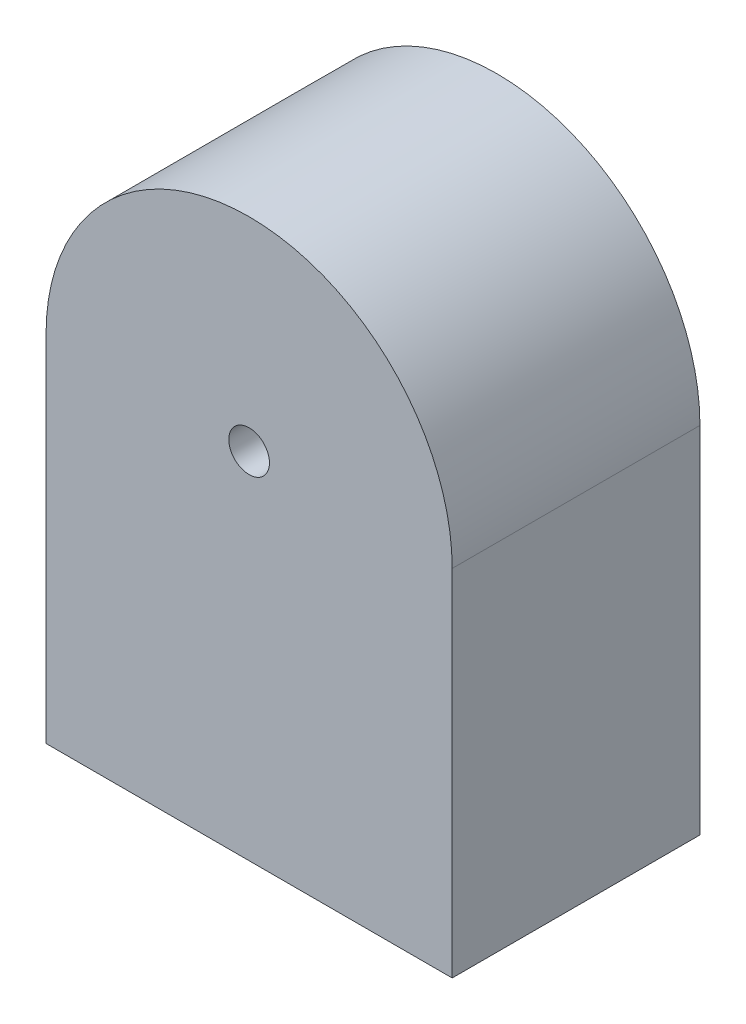
from build123d import *

# Parameters (mm, degrees)
ESQUISSE2_R           = 1.5
BOSS_EXTRU_2_DEPTH    = 18.3
BOSS_EXTRU_3_DEPTH    = 10
BOSS_EXTRU_3_2_DEPTH  = 10
BOSS_EXTRU_3_3_DEPTH  = 10
BOSS_EXTRU_3_4_DEPTH  = 10
BOSS_EXTRU_3_5_DEPTH  = 10
BOSS_EXTRU_3_6_DEPTH  = 10
BOSS_EXTRU_3_7_DEPTH  = 10
BOSS_EXTRU_3_8_DEPTH  = 10
BOSS_EXTRU_3_9_DEPTH  = 10
BOSS_EXTRU_3_10_DEPTH = 10
BOSS_EXTRU_3_11_DEPTH = 10
BOSS_EXTRU_3_12_DEPTH = 10
BOSS_EXTRU_3_13_DEPTH = 10
BOSS_EXTRU_3_14_DEPTH = 10
BOSS_EXTRU_3_15_DEPTH = 10
BOSS_EXTRU_3_16_DEPTH = 10
BOSS_EXTRU_3_17_DEPTH = 10
BOSS_EXTRU_3_18_DEPTH = 10
BOSS_EXTRU_3_19_DEPTH = 10


with BuildPart() as part:
    # Esquisse2 → Boss.-Extru.2 (new body)
    with BuildSketch(Plane.XY):
        with BuildLine():
            Line((0, 0), (30, 0))
            Line((30, 0), (30, 26.2))
            ThreePointArc((30, 26.2), (15, 41.2), (0, 26.2))
            Line((0, 26.2), (0, 0))
        make_face()
        with Locations((15, 26.2)):
            Circle(ESQUISSE2_R, mode=Mode.SUBTRACT)
    extrude(amount=BOSS_EXTRU_2_DEPTH)


with BuildPart() as body_2:
    # Esquisse7 → Boss.-Extru.3 (new body)
    with BuildSketch(Plane(origin=(0, 0, 0), x_dir=(0, 0, -1), z_dir=(1, 0, 0))):
        Polygon((-7.037443522, 3.676127023), (-3.537443522, 4.138166286), (-3.537443522, 4.183038081), (-6.409238393, 5.6280501), (-3.537443522, 7.06955651), (-3.537443522, 7.115129427), (-7.037443522, 7.579973177), (-7.037443522, 7.264468369), (-4.519014034, 6.929332151), (-7.037443522, 5.665910677), (-7.037443522, 5.595097376), (-4.51340506, 4.326768049), (-7.037443522, 3.992332953), align=None)
    extrude(amount=BOSS_EXTRU_3_DEPTH)


with BuildPart() as body_3:
    # Esquisse7 → Boss.-Extru.3 2 (new body)
    with BuildSketch(Plane(origin=(0, 0, 0), x_dir=(0, 0, -1), z_dir=(1, 0, 0))):
        with BuildLine():
            Line((-4.479751214, 10.810742408), (-7.037443522, 10.810742408))
            Line((-7.037443522, 10.810742408), (-7.037443522, 10.496639844))
            Line((-7.037443522, 10.496639844), (-6.595035669, 10.496639844))
            add(Edge.make_bspline(
                [(-6.595035669, 10.496639844), (-6.63508607, 10.461228459), (-6.713244931, 10.392122698), (-6.815048695, 10.276722712), (-6.899889849, 10.154907594), (-6.967776668, 10.026265422), (-7.019159047, 9.891181089), (-7.055292626, 9.750039821), (-7.078814598, 9.603029725), (-7.081137941, 9.502773909), (-7.082315316, 9.451968369)],
                knots=[0, 0, 0, 0, 1.074295371, 2.096500925, 3.086030275, 4.053105238, 5.014108356, 5.985331429, 6.979048527, 8, 8, 8, 8], degree=3))
            add(Edge.make_bspline(
                [(-7.082315316, 9.451968369), (-7.081089148, 9.406800293), (-7.078671089, 9.317726846), (-7.059905859, 9.186699534), (-7.029786042, 9.060600767), (-6.987845383, 8.939350181), (-6.932499602, 8.823769348), (-6.865523563, 8.713206999), (-6.786546981, 8.607405103), (-6.695908345, 8.50837579), (-6.59756602, 8.41706831), (-6.492369581, 8.337183486), (-6.381763898, 8.269478497), (-6.265780058, 8.213837123), (-6.144502845, 8.170778909), (-6.018015457, 8.140822043), (-5.886528364, 8.122077035), (-5.796988459, 8.119660201), (-5.75158615, 8.118434716)],
                knots=[0, 0, 0, 0, 1.034036272, 2.039165313, 3.024406509, 3.999331371, 4.971254918, 5.953351348, 6.95522652, 7.989525907, 9.023492927, 10.024309745, 11.009187477, 11.988246066, 12.964946762, 13.950187958, 14.960617622, 16, 16, 16, 16], degree=3))
            add(Edge.make_bspline(
                [(-5.75158615, 8.118434716), (-5.707122257, 8.119687382), (-5.619219539, 8.122163835), (-5.48994358, 8.140621466), (-5.365415208, 8.171636191), (-5.246095722, 8.21524436), (-5.131504584, 8.270915323), (-5.022538357, 8.339784685), (-4.917530164, 8.419640722), (-4.819847432, 8.511924048), (-4.729944158, 8.611842186), (-4.650775648, 8.718236033), (-4.58397133, 8.829778965), (-4.529665913, 8.946694641), (-4.486511523, 9.068155196), (-4.456428758, 9.195083299), (-4.438744908, 9.326901733), (-4.436180296, 9.416391285), (-4.434879419, 9.461784075)],
                knots=[0, 0, 0, 0, 1.02050356, 2.017480486, 2.990790918, 3.96161403, 4.928589988, 5.909588639, 6.91611943, 7.952353252, 8.989586576, 9.99823133, 10.991940466, 11.968822692, 12.952985106, 13.945868367, 14.958059758, 16, 16, 16, 16], degree=3))
            add(Edge.make_bspline(
                [(-4.434879419, 9.461784075), (-4.43631017, 9.513985966), (-4.439115805, 9.61635141), (-4.462712624, 9.766273796), (-4.502087721, 9.908231956), (-4.5562035, 10.043044155), (-4.627582662, 10.170187424), (-4.718437268, 10.288096968), (-4.826691746, 10.399146497), (-4.910084212, 10.463510211), (-4.953008425, 10.496639844)],
                knots=[0, 0, 0, 0, 1.03879612, 2.037030165, 3.012306674, 3.966139504, 4.922386257, 5.905048148, 6.921675258, 8, 8, 8, 8], degree=3))
            Line((-4.953008425, 10.496639844), (-4.479751214, 10.496639844))
            Line((-4.479751214, 10.496639844), (-4.479751214, 10.810742408))
        make_face()
        with BuildLine():
            add(Edge.make_bspline(
                [(-4.748981983, 9.465990805), (-4.750615603, 9.42007644), (-4.75384011, 9.329448785), (-4.779013859, 9.196405183), (-4.820897498, 9.069090267), (-4.878182993, 8.948149842), (-4.950198403, 8.835460678), (-5.037369075, 8.734844481), (-5.136922954, 8.645097484), (-5.249697037, 8.570896215), (-5.369217587, 8.508337163), (-5.495105563, 8.465437185), (-5.623868466, 8.436890147), (-5.71123677, 8.433992013), (-5.755091759, 8.43253728)],
                knots=[0, 0, 0, 0, 1.031093775, 2.03521511, 3.029845951, 4.035119871, 5.034286494, 6.024708811, 7.017619509, 8.03559408, 9.050082311, 10.039808432, 11.016071318, 12, 12, 12, 12], degree=3))
            add(Edge.make_bspline(
                [(-5.755091759, 8.43253728), (-5.79867603, 8.434419364), (-5.885673736, 8.438176156), (-6.014819211, 8.464684706), (-6.140200396, 8.510615036), (-6.261376567, 8.571746171), (-6.374382132, 8.647611833), (-6.475882776, 8.736613988), (-6.56340304, 8.838513225), (-6.636657528, 8.951446821), (-6.695623909, 9.071881997), (-6.737203661, 9.198593638), (-6.763459035, 9.329355382), (-6.76662285, 9.418425949), (-6.768212752, 9.463186318)],
                knots=[0, 0, 0, 0, 0.979154363, 1.954470772, 2.947816011, 3.971783346, 4.997163654, 5.998045606, 6.995988793, 8.00538986, 9.015323546, 10.000094788, 10.994993517, 12, 12, 12, 12], degree=3))
            add(Edge.make_bspline(
                [(-6.768212752, 9.463186318), (-6.766577648, 9.508638221), (-6.763333859, 9.598807636), (-6.737739108, 9.732164376), (-6.696376236, 9.86177931), (-6.638270826, 9.985724373), (-6.566588399, 10.101102823), (-6.482299497, 10.204524931), (-6.385093403, 10.292835733), (-6.27740407, 10.366867986), (-6.159899145, 10.425349756), (-6.034259348, 10.466597704), (-5.901472028, 10.491931651), (-5.810594229, 10.495048746), (-5.764206342, 10.496639844)],
                knots=[0, 0, 0, 0, 1.017484689, 2.018529338, 3.030031036, 4.058138743, 5.076350332, 6.065651025, 7.036469986, 8.00785331, 8.984076697, 9.96571663, 10.961615403, 12, 12, 12, 12], degree=3))
            add(Edge.make_bspline(
                [(-5.764206342, 10.496639844), (-5.728868525, 10.495680172), (-5.659312519, 10.493791235), (-5.557184806, 10.479360882), (-5.459451794, 10.456405162), (-5.366006508, 10.42406188), (-5.277381146, 10.381559859), (-5.192881006, 10.330352554), (-5.113293197, 10.269389626), (-5.038718509, 10.200526333), (-4.971039165, 10.124299303), (-4.911387159, 10.043241735), (-4.860905148, 9.95755757), (-4.820506335, 9.867306954), (-4.787594435, 9.773185002), (-4.765856693, 9.674289575), (-4.750882745, 9.571617356), (-4.749622241, 9.501570368), (-4.748981983, 9.465990805)],
                knots=[0, 0, 0, 0, 1.050062701, 2.066855696, 3.059271411, 4.030305351, 4.999747758, 5.975466543, 6.961907836, 7.974539719, 8.98812422, 9.98710676, 10.961662635, 11.93785114, 12.922015094, 13.919620009, 14.94329489, 16, 16, 16, 16], degree=3))
        make_face(mode=Mode.SUBTRACT)
    extrude(amount=BOSS_EXTRU_3_2_DEPTH)


with BuildPart() as body_4:
    # Esquisse7 → Boss.-Extru.3 3 (new body)
    with BuildSketch(Plane(origin=(0, 0, 0), x_dir=(0, 0, -1), z_dir=(1, 0, 0))):
        Polygon((-4.479751214, 11.304332151), (-4.479751214, 11.678030068), (-5.402427496, 12.336383434), (-4.479751214, 12.994736799), (-4.479751214, 13.368434716), (-5.663945925, 12.523582953), (-7.037443522, 13.5030501), (-7.037443522, 13.129352184), (-5.926165477, 12.336383434), (-7.037443522, 11.543414684), (-7.037443522, 11.169716767), (-5.663945925, 12.149885036), align=None)
    extrude(amount=BOSS_EXTRU_3_3_DEPTH)


with BuildPart() as body_5:
    # Esquisse7 → Boss.-Extru.3 4 (new body)
    with BuildSketch(Plane(origin=(0, 0, 0), x_dir=(0, 0, -1), z_dir=(1, 0, 0))):
        with BuildLine():
            add(Edge.make_bspline(
                [(-4.434879419, 15.097401062), (-4.435898311, 15.145393526), (-4.43789611, 15.239495019), (-4.459353542, 15.377286035), (-4.491892367, 15.508679763), (-4.537694996, 15.634239841), (-4.597789834, 15.752927635), (-4.670462377, 15.865802832), (-4.756204293, 15.97263928), (-4.822567949, 16.036659639), (-4.856253618, 16.069155869)],
                knots=[0, 0, 0, 0, 1.054042676, 2.066720093, 3.05716247, 4.025731183, 4.997454851, 5.974904663, 6.97207755, 8, 8, 8, 8], degree=3))
            add(Edge.make_bspline(
                [(-4.856253618, 16.069155869), (-4.888467603, 16.097137823), (-4.952272146, 16.152560204), (-5.055727759, 16.223625922), (-5.162867859, 16.284847483), (-5.275115186, 16.333910444), (-5.391489857, 16.372595467), (-5.512391868, 16.400061164), (-5.637554215, 16.416398099), (-5.722558053, 16.418601065), (-5.765608586, 16.419716767)],
                knots=[0, 0, 0, 0, 1.025258237, 2.030674902, 3.01204498, 3.988269485, 4.97094183, 5.956517959, 6.965070386, 8, 8, 8, 8], degree=3))
            add(Edge.make_bspline(
                [(-5.765608586, 16.419716767), (-5.808908643, 16.41873543), (-5.894471577, 16.416796261), (-6.020490942, 16.398452644), (-6.142685768, 16.36992156), (-6.260544448, 16.329089716), (-6.374427326, 16.27673163), (-6.483836683, 16.212840855), (-6.588989557, 16.136969573), (-6.688988526, 16.050964277), (-6.781165442, 15.955917247), (-6.861454956, 15.852783549), (-6.930531474, 15.74351517), (-6.985397436, 15.626620489), (-7.029623223, 15.503763462), (-7.060119749, 15.374162644), (-7.078723458, 15.237933649), (-7.081101189, 15.144904193), (-7.082315316, 15.097401062)],
                knots=[0, 0, 0, 0, 0.998669827, 1.973418153, 2.932281609, 3.89081133, 4.846438734, 5.82045571, 6.809776312, 7.834649874, 8.860672198, 9.859676908, 10.845817165, 11.837296335, 12.833502054, 13.853824644, 14.904110009, 16, 16, 16, 16], degree=3))
            add(Edge.make_bspline(
                [(-7.082315316, 15.097401062), (-7.081091143, 15.049667478), (-7.078693537, 14.956178842), (-7.060258134, 14.819436887), (-7.02929738, 14.689290409), (-6.985944942, 14.565852241), (-6.930080823, 14.448958033), (-6.861723727, 14.339286179), (-6.781124785, 14.236103836), (-6.688999542, 14.141027006), (-6.588986718, 14.0550297), (-6.48383742, 13.979156357), (-6.374427134, 13.915266117), (-6.260544499, 13.862907891), (-6.142685754, 13.822076084), (-6.020490945, 13.79354499), (-5.894471576, 13.775201375), (-5.808908643, 13.773262207), (-5.765608586, 13.772280869)],
                knots=[0, 0, 0, 0, 1.099861214, 2.154133753, 3.1731438, 4.178222029, 5.163564916, 6.153006591, 7.15072618, 8.175428628, 9.198983792, 10.187031731, 11.15979573, 12.114193814, 13.071490482, 14.029120454, 15.002614863, 16, 16, 16, 16], degree=3))
            add(Edge.make_bspline(
                [(-5.765608586, 13.772280869), (-5.72279204, 13.77340418), (-5.638022637, 13.775628141), (-5.513095577, 13.79194865), (-5.392398188, 13.819307207), (-5.276472712, 13.858038603), (-5.164717276, 13.907553794), (-5.057312445, 13.967915082), (-4.954324644, 14.039705715), (-4.890602564, 14.094907666), (-4.858356983, 14.122841767)],
                knots=[0, 0, 0, 0, 1.031353054, 2.041901799, 3.029428768, 4.008703097, 4.981709435, 5.96992636, 6.972712378, 8, 8, 8, 8], degree=3))
            add(Edge.make_bspline(
                [(-4.858356983, 14.122841767), (-4.824384858, 14.155291695), (-4.757572695, 14.219110188), (-4.671999952, 14.326439808), (-4.598347609, 14.438829455), (-4.538283014, 14.558282826), (-4.491975472, 14.684192033), (-4.459201673, 14.816562305), (-4.437991022, 14.954854853), (-4.435926957, 15.049412125), (-4.434879419, 15.097401062)],
                knots=[0, 0, 0, 0, 1.027951202, 2.021646915, 2.998468564, 3.9668038, 4.943370589, 5.93035926, 6.949632805, 8, 8, 8, 8], degree=3))
        make_face()
        with BuildLine():
            add(Edge.make_bspline(
                [(-4.748981983, 15.095998818), (-4.749946627, 15.062061245), (-4.751851012, 14.995062191), (-4.766334165, 14.896442057), (-4.789284452, 14.801503936), (-4.821878248, 14.710055595), (-4.864015877, 14.622450724), (-4.915479624, 14.538592933), (-4.97654359, 14.458707517), (-5.045994072, 14.383408169), (-5.121429475, 14.31349077), (-5.202545578, 14.253076634), (-5.28701532, 14.20161052), (-5.375277161, 14.158781149), (-5.468166981, 14.126871056), (-5.564648316, 14.103698821), (-5.664913543, 14.089228368), (-5.733074587, 14.087342019), (-5.767711951, 14.086383434)],
                knots=[0, 0, 0, 0, 1.021589593, 2.016807015, 2.994807536, 3.958602519, 4.934347097, 5.916793557, 6.916107818, 7.957073844, 8.998039869, 10.008589932, 10.997041759, 11.972786337, 12.956492182, 13.948170289, 14.957322718, 16, 16, 16, 16], degree=3))
            add(Edge.make_bspline(
                [(-5.767711951, 14.086383434), (-5.812465956, 14.087986017), (-5.901294287, 14.091166846), (-6.032076328, 14.117164432), (-6.157866801, 14.160347633), (-6.277151153, 14.219894376), (-6.387708682, 14.293227981), (-6.487122533, 14.378976592), (-6.57155891, 14.478325714), (-6.642571325, 14.587892317), (-6.698493535, 14.706123705), (-6.738597195, 14.831037676), (-6.764316015, 14.961496853), (-6.766902472, 15.050772449), (-6.768212752, 15.095998818)],
                knots=[0, 0, 0, 0, 1.016977094, 2.018509362, 3.018404954, 4.033172147, 5.041280572, 6.028085189, 7.007940189, 7.995502847, 8.989109012, 9.972200833, 10.97273166, 12, 12, 12, 12], degree=3))
            add(Edge.make_bspline(
                [(-6.768212752, 15.095998818), (-6.766910062, 15.141227788), (-6.764338588, 15.23050852), (-6.738466895, 15.361149214), (-6.69866792, 15.486405535), (-6.642508164, 15.604759853), (-6.571827318, 15.714376353), (-6.486641507, 15.813016053), (-6.387970023, 15.89950312), (-6.277297744, 15.972909339), (-6.157681358, 16.031496618), (-6.032099506, 16.074882898), (-5.901288384, 16.100818135), (-5.812463978, 16.104007379), (-5.767711951, 16.105614203)],
                knots=[0, 0, 0, 0, 1.027082318, 2.027431966, 3.015401697, 4.008827937, 4.996211763, 5.971861488, 6.96198607, 7.969911943, 8.982141629, 9.981856156, 10.983207064, 12, 12, 12, 12], degree=3))
            add(Edge.make_bspline(
                [(-5.767711951, 16.105614203), (-5.733071821, 16.10466275), (-5.664905334, 16.102790436), (-5.564679694, 16.088217896), (-5.467976154, 16.06540562), (-5.375651501, 16.032098175), (-5.286584244, 15.990738733), (-5.202799227, 15.938020646), (-5.121377909, 15.877887906), (-5.04603954, 15.807842211), (-4.976289834, 15.73255134), (-4.915702066, 15.652065781), (-4.863986488, 15.568169044), (-4.821873059, 15.480536488), (-4.789409906, 15.389295089), (-4.76623419, 15.294645206), (-4.751903819, 15.196461808), (-4.749962158, 15.129700663), (-4.748981983, 15.095998818)],
                knots=[0, 0, 0, 0, 1.043020522, 2.052505155, 3.044509714, 4.030878336, 5.003918577, 5.996372628, 7.007255355, 8.048564058, 9.08987276, 10.095126797, 11.077896669, 12.053962454, 13.01807471, 13.98956039, 14.985105429, 16, 16, 16, 16], degree=3))
        make_face(mode=Mode.SUBTRACT)
    extrude(amount=BOSS_EXTRU_3_4_DEPTH)


with BuildPart() as body_6:
    # Esquisse7 → Boss.-Extru.3 5 (new body)
    with BuildSketch(Plane(origin=(0, 0, 0), x_dir=(0, 0, -1), z_dir=(1, 0, 0))):
        with BuildLine():
            Line((-4.479751214, 17.047921895), (-4.479751214, 17.362024459))
            Line((-4.479751214, 17.362024459), (-4.941089355, 17.362024459))
            add(Edge.make_bspline(
                [(-4.941089355, 17.362024459), (-4.899246632, 17.395562094), (-4.818049369, 17.460643045), (-4.711328794, 17.569027379), (-4.623383569, 17.683571279), (-4.553279775, 17.803573282), (-4.500433149, 17.929196293), (-4.462267218, 18.059674562), (-4.439382389, 18.195789269), (-4.436392159, 18.288353705), (-4.434879419, 18.33518151)],
                knots=[0, 0, 0, 0, 1.12780773, 2.188550248, 3.19190651, 4.159438251, 5.104880172, 6.052711206, 7.014878035, 8, 8, 8, 8], degree=3))
            add(Edge.make_bspline(
                [(-4.434879419, 18.33518151), (-4.436627211, 18.382510866), (-4.440048061, 18.47514583), (-4.467028153, 18.610041919), (-4.513379278, 18.736142571), (-4.576230354, 18.853171546), (-4.654810581, 18.958439547), (-4.746848235, 19.050051285), (-4.851902363, 19.126469176), (-4.949662218, 19.177628859), (-5.036345742, 19.211359918), (-5.110593727, 19.232590987), (-5.193311501, 19.250622356), (-5.284251206, 19.266253985), (-5.384049361, 19.276831133), (-5.492297063, 19.285173414), (-5.608959191, 19.291152111), (-5.689645819, 19.291389318), (-5.731253618, 19.291511639)],
                knots=[0, 0, 0, 0, 1.235764744, 2.418689688, 3.575570385, 4.733739044, 5.876600945, 6.994686206, 8.113221397, 9.257403329, 9.866223892, 10.540462211, 11.272173464, 12.077110251, 12.949508505, 13.892531187, 14.913238277, 16, 16, 16, 16], degree=3))
            Line((-5.731253618, 19.291511639), (-7.037443522, 19.291511639))
            Line((-7.037443522, 19.291511639), (-7.037443522, 18.977409075))
            Line((-7.037443522, 18.977409075), (-5.834318522, 18.977409075))
            add(Edge.make_bspline(
                [(-5.834318522, 18.977409075), (-5.799496077, 18.977215867), (-5.732886666, 18.976846292), (-5.637517643, 18.975680646), (-5.551031064, 18.972870839), (-5.473633697, 18.968922526), (-5.40539986, 18.963143496), (-5.346190584, 18.957120864), (-5.296081041, 18.949755888), (-5.265915959, 18.943192974), (-5.252387432, 18.940249619)],
                knots=[0, 0, 0, 0, 1.430800155, 2.736877192, 3.918605307, 4.986035426, 5.920637409, 6.731861385, 7.431261377, 8, 8, 8, 8], degree=3))
            add(Edge.make_bspline(
                [(-5.252387432, 18.940249619), (-5.212676247, 18.929624088), (-5.136244502, 18.909173227), (-5.03257015, 18.858639244), (-4.944371962, 18.794825063), (-4.87219524, 18.716927214), (-4.816024403, 18.625698138), (-4.777050449, 18.521390996), (-4.75267418, 18.405012355), (-4.750247047, 18.323157972), (-4.748981983, 18.28049401)],
                knots=[0, 0, 0, 0, 1.084156227, 2.086665306, 3.027808233, 3.945421172, 4.874247719, 5.839848303, 6.874090471, 8, 8, 8, 8], degree=3))
            add(Edge.make_bspline(
                [(-4.748981983, 18.28049401), (-4.74945781, 18.255226238), (-4.750399461, 18.20522197), (-4.759853343, 18.131073288), (-4.775302122, 18.059144285), (-4.796206439, 17.988741887), (-4.824652809, 17.921359516), (-4.857579868, 17.855028084), (-4.897900207, 17.791645874), (-4.943079699, 17.730014108), (-4.993431054, 17.672742783), (-5.045783263, 17.618689827), (-5.102340369, 17.571198468), (-5.161099637, 17.528089359), (-5.223242224, 17.490921779), (-5.288103651, 17.458465829), (-5.35578657, 17.4309309), (-5.402761528, 17.417248105), (-5.426265637, 17.410401863)],
                knots=[0, 0, 0, 0, 1.02388931, 2.02625049, 3.024079426, 4.004119353, 4.998163158, 5.985366248, 7.002659681, 8.039138713, 9.080111048, 10.09169763, 11.086418407, 12.069932368, 13.043171485, 14.017654831, 15.008125612, 16, 16, 16, 16], degree=3))
            add(Edge.make_bspline(
                [(-5.426265637, 17.410401863), (-5.44352084, 17.406462214), (-5.481084514, 17.397885806), (-5.542728934, 17.388622626), (-5.614038909, 17.38021505), (-5.694931226, 17.373178092), (-5.785689101, 17.368872675), (-5.885924939, 17.364178278), (-5.996038427, 17.362469217), (-6.07270012, 17.362176863), (-6.112663874, 17.362024459)],
                knots=[0, 0, 0, 0, 0.615963638, 1.340920617, 2.168419149, 3.115676021, 4.16674242, 5.331190069, 6.6087489, 8, 8, 8, 8], degree=3))
            Line((-6.112663874, 17.362024459), (-7.037443522, 17.362024459))
            Line((-7.037443522, 17.362024459), (-7.037443522, 17.047921895))
            Line((-7.037443522, 17.047921895), (-4.479751214, 17.047921895))
        make_face()
    extrude(amount=BOSS_EXTRU_3_5_DEPTH)


with BuildPart() as body_7:
    # Esquisse7 → Boss.-Extru.3 6 (new body)
    with BuildSketch(Plane(origin=(0, 0, 0), x_dir=(0, 0, -1), z_dir=(1, 0, 0))):
        Polygon((-3.537443522, 21.875145453), (-3.537443522, 22.522280869), (-7.037443522, 22.522280869), (-7.037443522, 22.208178305), (-3.896417881, 22.208178305), (-3.896417881, 21.669716767), align=None)
    extrude(amount=BOSS_EXTRU_3_6_DEPTH)


with BuildPart() as body_8:
    # Esquisse7 → Boss.-Extru.3 7 (new body)
    with BuildSketch(Plane(origin=(0, 0, 0), x_dir=(0, 0, -1), z_dir=(1, 0, 0))):
        Polygon((-3.537443522, 24.567453145), (-3.537443522, 25.214588562), (-7.037443522, 25.214588562), (-7.037443522, 24.900485998), (-3.896417881, 24.900485998), (-3.896417881, 24.362024459), align=None)
    extrude(amount=BOSS_EXTRU_3_7_DEPTH)


with BuildPart() as body_9:
    # Esquisse7 → Boss.-Extru.3 8 (new body)
    with BuildSketch(Plane(origin=(0, 0, 0), x_dir=(0, 0, -1), z_dir=(1, 0, 0))):
        with BuildLine():
            add(Edge.make_bspline(
                [(-5.288845765, 26.515870613), (-5.232748377, 26.516198631), (-5.123778393, 26.516835811), (-4.964993751, 26.523924232), (-4.816033462, 26.535699574), (-4.676890398, 26.551836949), (-4.547528625, 26.571474921), (-4.428293895, 26.597690436), (-4.3186342, 26.627503142), (-4.218192449, 26.662055913), (-4.125613722, 26.701042583), (-4.039192131, 26.743480792), (-3.959037395, 26.791031586), (-3.883945377, 26.841058548), (-3.814754137, 26.895389794), (-3.751594709, 26.953452263), (-3.694428955, 27.015821913), (-3.642576506, 27.081265214), (-3.597406412, 27.150195748), (-3.556705155, 27.220488617), (-3.523299145, 27.293384197), (-3.495850125, 27.368217656), (-3.473855921, 27.444771371), (-3.458624978, 27.523361655), (-3.44907927, 27.604007495), (-3.448164073, 27.658438319), (-3.447699932, 27.686042889)],
                knots=[0, 0, 0, 0, 1.646377244, 3.198111528, 4.663803227, 6.031090796, 7.308794487, 8.502186765, 9.612154809, 10.642545331, 11.617106989, 12.558866172, 13.465886467, 14.35053239, 15.20542558, 16.045215227, 16.865619885, 17.686225247, 18.492864914, 19.282407821, 20.068097601, 20.842842034, 21.620163247, 22.403093475, 23.190129512, 24, 24, 24, 24], degree=3))
            add(Edge.make_bspline(
                [(-3.447699932, 27.686042889), (-3.448187747, 27.713878367), (-3.449157858, 27.769234376), (-3.4584818, 27.851074751), (-3.473952924, 27.931024433), (-3.495873898, 28.008742572), (-3.523069575, 28.084867558), (-3.557156692, 28.158803966), (-3.596835559, 28.231011047), (-3.643459437, 28.300341335), (-3.695441713, 28.36755595), (-3.754204382, 28.431003913), (-3.819154101, 28.490690999), (-3.889595965, 28.547366305), (-3.966881049, 28.599421902), (-4.049665159, 28.648995334), (-4.139396024, 28.69336737), (-4.234576492, 28.736102045), (-4.337840151, 28.772989032), (-4.448604911, 28.806255277), (-4.568179098, 28.833134246), (-4.695935343, 28.855523518), (-4.832342827, 28.872868414), (-4.977109142, 28.885501056), (-5.130329533, 28.892174141), (-5.235087382, 28.893430842), (-5.288845765, 28.894075741)],
                knots=[0, 0, 0, 0, 0.810914788, 1.612654377, 2.396697861, 3.181598691, 3.963628158, 4.749916497, 5.551656086, 6.361998678, 7.18212741, 8.025565596, 8.878627764, 9.750805457, 10.657531673, 11.591944965, 12.560506719, 13.57287815, 14.630710178, 15.753379473, 16.941251878, 18.199788006, 19.531962791, 20.947069417, 22.433333509, 24, 24, 24, 24], degree=3))
            add(Edge.make_bspline(
                [(-5.288845765, 28.894075741), (-5.342369473, 28.893423351), (-5.446658235, 28.892152196), (-5.599191975, 28.885584616), (-5.743180305, 28.872586895), (-5.879024032, 28.856510766), (-6.005916609, 28.833610542), (-6.125064631, 28.807577023), (-6.23543987, 28.775220154), (-6.338158925, 28.738835938), (-6.43287307, 28.697028563), (-6.521828254, 28.652264361), (-6.604544815, 28.60299522), (-6.681828777, 28.550629175), (-6.752881555, 28.494435603), (-6.817878753, 28.434495777), (-6.876777501, 28.370764075), (-6.929470018, 28.303397495), (-6.975551161, 28.232976544), (-7.016740291, 28.161010481), (-7.050162715, 28.086062927), (-7.078381916, 28.009799531), (-7.100353321, 27.931500698), (-7.115396993, 27.851243229), (-7.125976936, 27.769289964), (-7.126782323, 27.713887997), (-7.127187111, 27.686042889)],
                knots=[0, 0, 0, 0, 1.56130642, 3.042141888, 4.451772327, 5.777565838, 7.030558081, 8.211376819, 9.333164717, 10.383253789, 11.387583522, 12.350962576, 13.286244149, 14.193812918, 15.072134482, 15.925989337, 16.770211267, 17.600669898, 18.417446232, 19.22325363, 20.01647746, 20.807971184, 21.593601364, 22.38506573, 23.188331689, 24, 24, 24, 24], degree=3))
            add(Edge.make_bspline(
                [(-7.127187111, 27.686042889), (-7.126718503, 27.65843944), (-7.1257945, 27.604010828), (-7.116313305, 27.523348789), (-7.100852672, 27.444881074), (-7.079857209, 27.368450821), (-7.05317322, 27.293901612), (-7.019232175, 27.221963732), (-6.979865843, 27.151687129), (-6.935079273, 27.083392475), (-6.883755031, 27.018381428), (-6.826991943, 26.956281511), (-6.763366275, 26.898660724), (-6.693896455, 26.845010422), (-6.619171934, 26.794099198), (-6.538456619, 26.747014366), (-6.451225309, 26.704658935), (-6.358135518, 26.664798542), (-6.256955571, 26.629661681), (-6.146710996, 26.598858714), (-6.026791947, 26.573180132), (-5.897554428, 26.552529284), (-5.75890171, 26.535504737), (-5.610589668, 26.52397999), (-5.452746261, 26.516830166), (-5.344476232, 26.516196301), (-5.288845765, 26.515870613)],
                knots=[0, 0, 0, 0, 0.810940842, 1.599017053, 2.38298203, 3.159479784, 3.926441347, 4.70693857, 5.494146311, 6.292334103, 7.104379492, 7.925868426, 8.762126819, 9.623561095, 10.503686106, 11.41783325, 12.366995289, 13.351843594, 14.392337808, 15.512229747, 16.713911458, 17.994391108, 19.357476964, 20.818259213, 22.365182633, 24, 24, 24, 24], degree=3))
        make_face()
        with BuildLine():
            add(Edge.make_bspline(
                [(-5.287443522, 26.829973177), (-5.33419222, 26.830092624), (-5.424922265, 26.830324447), (-5.556765526, 26.836380648), (-5.679735856, 26.844630879), (-5.793989389, 26.855272179), (-5.89913941, 26.871075119), (-5.995909065, 26.888781937), (-6.083786394, 26.910329925), (-6.163373902, 26.93582528), (-6.236024002, 26.964863228), (-6.303621615, 26.996573105), (-6.366986303, 27.030619621), (-6.425474491, 27.068789376), (-6.479668389, 27.110216597), (-6.529412256, 27.154969311), (-6.57448905, 27.202968811), (-6.627977036, 27.269415853), (-6.683903544, 27.356706322), (-6.732004611, 27.467253157), (-6.762428691, 27.580894543), (-6.766286967, 27.658049357), (-6.768212752, 27.696559716)],
                knots=[0, 0, 0, 0, 1.459116078, 2.831857795, 4.118796693, 5.306371758, 6.412361096, 7.436813035, 8.376339383, 9.234574298, 10.043323891, 10.816788787, 11.564361537, 12.286735248, 12.994408768, 13.691741332, 14.372975427, 15.047457468, 16.352811911, 17.594285292, 18.799233213, 20, 20, 20, 20], degree=3))
            add(Edge.make_bspline(
                [(-6.768212752, 27.696559716), (-6.766614971, 27.735317387), (-6.763422709, 27.81275271), (-6.732623971, 27.925886506), (-6.686154432, 28.035716776), (-6.631206926, 28.121788716), (-6.578878597, 28.187271259), (-6.534263949, 28.23418825), (-6.484308081, 28.277250298), (-6.430408785, 28.318092373), (-6.371536301, 28.355551448), (-6.307973726, 28.389614586), (-6.239544548, 28.420697934), (-6.191774809, 28.43840698), (-6.167351374, 28.447461158)],
                knots=[0, 0, 0, 0, 1.353760809, 2.704726607, 4.075137775, 5.516104923, 6.260822281, 7.007110065, 7.778089737, 8.566572457, 9.372053459, 10.217411131, 11.088608312, 12, 12, 12, 12], degree=3))
            add(Edge.make_bspline(
                [(-6.167351374, 28.447461158), (-6.136121635, 28.458012926), (-6.07271187, 28.479437539), (-5.974348218, 28.507049314), (-5.871145454, 28.528794713), (-5.763720338, 28.548358079), (-5.651280637, 28.561711135), (-5.534174253, 28.572458948), (-5.41231289, 28.578789635), (-5.329517899, 28.579574386), (-5.287443522, 28.579973177)],
                knots=[0, 0, 0, 0, 0.884706709, 1.796334032, 2.740027952, 3.714592787, 4.726048262, 5.777819803, 6.87074269, 8, 8, 8, 8], degree=3))
            add(Edge.make_bspline(
                [(-5.287443522, 28.579973177), (-5.245370048, 28.579533353), (-5.163055159, 28.578672857), (-5.042628401, 28.573019319), (-4.928049059, 28.563934553), (-4.81921319, 28.551638521), (-4.716314509, 28.534758671), (-4.61920577, 28.51448765), (-4.527913151, 28.490722204), (-4.442201218, 28.463462529), (-4.362378042, 28.432741252), (-4.288269832, 28.398803454), (-4.21948371, 28.362587224), (-4.156217119, 28.323243597), (-4.098184488, 28.281248263), (-4.046549915, 28.235490625), (-3.999712942, 28.187786274), (-3.946250374, 28.120969081), (-3.891738678, 28.033494795), (-3.841572918, 27.924649147), (-3.812764626, 27.811378503), (-3.808702939, 27.734805048), (-3.806674291, 27.696559716)],
                knots=[0, 0, 0, 0, 1.313668642, 2.570134578, 3.763346207, 4.902004944, 5.98888779, 7.017888835, 7.998425394, 8.933058446, 9.82474457, 10.667209444, 11.476765193, 12.250262638, 12.991704352, 13.7104269, 14.401925311, 15.076585796, 16.378385137, 17.609787933, 18.806186071, 20, 20, 20, 20], degree=3))
            add(Edge.make_bspline(
                [(-3.806674291, 27.696559716), (-3.80870312, 27.657847498), (-3.812764475, 27.580352539), (-3.841497376, 27.465929207), (-3.891271623, 27.3563082), (-3.946602393, 27.269535711), (-3.998766503, 27.202802821), (-4.044128612, 27.155680084), (-4.094022963, 27.111625231), (-4.147987418, 27.070163496), (-4.206505105, 27.032030485), (-4.269860579, 26.997970036), (-4.337464473, 26.96627836), (-4.410098043, 26.93717807), (-4.489805534, 26.91191899), (-4.577239355, 26.889342032), (-4.674099397, 26.871645956), (-4.779543389, 26.85620361), (-4.893937377, 26.844429697), (-5.017191211, 26.836401827), (-5.14926247, 26.83031349), (-5.240460645, 26.830088887), (-5.287443522, 26.829973177)],
                knots=[0, 0, 0, 0, 1.207964612, 2.418129846, 3.655795183, 4.951004962, 5.620895151, 6.296795572, 6.989224116, 7.696855977, 8.419187164, 9.166715907, 9.940135271, 10.748837255, 11.607021648, 12.548275234, 13.5654991, 14.678641405, 15.874140913, 17.15372626, 18.533675393, 20, 20, 20, 20], degree=3))
        make_face(mode=Mode.SUBTRACT)
    extrude(amount=BOSS_EXTRU_3_8_DEPTH)


with BuildPart() as body_10:
    # Esquisse7 → Boss.-Extru.3 9 (new body)
    with BuildSketch(Plane(origin=(0, 0, 0), x_dir=(0, 0, -1), z_dir=(1, 0, 0))):
        with BuildLine():
            Line((-3.537443522, 31.406896254), (-3.896417881, 31.406896254))
            Line((-3.896417881, 31.406896254), (-3.896417881, 30.216391446))
            Line((-3.896417881, 30.216391446), (-4.816990797, 30.027789684))
            add(Edge.make_bspline(
                [(-4.816990797, 30.027789684), (-4.806760525, 30.064845558), (-4.786940992, 30.136635454), (-4.764935221, 30.242595315), (-4.751669777, 30.343187518), (-4.749858467, 30.408462889), (-4.748981983, 30.440049299)],
                knots=[0, 0, 0, 0, 1.100273476, 2.13160584, 3.095893838, 4, 4, 4, 4], degree=3))
            add(Edge.make_bspline(
                [(-4.748981983, 30.440049299), (-4.74982814, 30.479132904), (-4.751491896, 30.555981036), (-4.767460599, 30.668421899), (-4.79261194, 30.775747833), (-4.827690991, 30.877775464), (-4.872837262, 30.974724551), (-4.928501669, 31.066053685), (-4.994299188, 31.152280462), (-5.069594983, 31.232264997), (-5.152565946, 31.30471442), (-5.2414849, 31.368665751), (-5.336432725, 31.42185262), (-5.436989568, 31.465610255), (-5.542986707, 31.500327714), (-5.65520873, 31.5234983), (-5.77265977, 31.538909868), (-5.852963934, 31.540632968), (-5.893913874, 31.541511639)],
                knots=[0, 0, 0, 0, 1.052772836, 2.070014431, 3.053871312, 4.019926262, 4.972333346, 5.930471369, 6.896690565, 7.89035727, 8.885779078, 9.861050232, 10.836829716, 11.812751485, 12.812646763, 13.836748493, 14.896881366, 16, 16, 16, 16], degree=3))
            add(Edge.make_bspline(
                [(-5.893913874, 31.541511639), (-5.922436132, 31.540846653), (-5.979095194, 31.539525668), (-6.063238846, 31.532805767), (-6.14560372, 31.519874937), (-6.226188581, 31.502489183), (-6.304885695, 31.480013188), (-6.381666437, 31.452508885), (-6.456767227, 31.420088092), (-6.530192984, 31.383484248), (-6.599680109, 31.341140385), (-6.666301241, 31.296536066), (-6.727604581, 31.247126759), (-6.78582811, 31.195304616), (-6.838685298, 31.138997483), (-6.888438134, 31.079953044), (-6.932925456, 31.016785672), (-6.973843749, 30.950626299), (-7.0104804, 30.881516644), (-7.04104191, 30.808755949), (-7.067829338, 30.733941502), (-7.089613017, 30.656406488), (-7.106514003, 30.576301119), (-7.118023345, 30.493349543), (-7.126397393, 30.407967999), (-7.126922076, 30.350093106), (-7.127187111, 30.320858594)],
                knots=[0, 0, 0, 0, 1.05623316, 2.098192244, 3.122504159, 4.140841222, 5.148757784, 6.150489607, 7.158294732, 8.176043417, 9.185147859, 10.169157858, 11.142149047, 12.097904048, 13.0527185, 13.998867679, 14.954465986, 15.910220987, 16.877849176, 17.847023716, 18.829548819, 19.818454515, 20.826519638, 21.858115382, 22.918063636, 24, 24, 24, 24], degree=3))
            add(Edge.make_bspline(
                [(-7.127187111, 30.320858594), (-7.126496213, 30.285984456), (-7.125136952, 30.217373709), (-7.110919329, 30.116852533), (-7.090552262, 30.02014015), (-7.059927471, 29.928001952), (-7.021497817, 29.839660568), (-6.973236888, 29.756291989), (-6.917782883, 29.67625757), (-6.853222455, 29.60173255), (-6.781995498, 29.532704686), (-6.705529048, 29.469964353), (-6.623519063, 29.414941458), (-6.536663723, 29.367411454), (-6.444813579, 29.326927608), (-6.347693781, 29.29510871), (-6.245792899, 29.269431426), (-6.17563951, 29.258567858), (-6.140007624, 29.2530501)],
                knots=[0, 0, 0, 0, 1.046825758, 2.059506013, 3.044032586, 4.011925612, 4.970610144, 5.93275819, 6.900651216, 7.891265644, 8.889116719, 9.876966323, 10.858259055, 11.851035124, 12.847502422, 13.86866322, 14.9174643, 16, 16, 16, 16], degree=3))
            Line((-6.140007624, 29.2530501), (-6.140007624, 29.567152664))
            add(Edge.make_bspline(
                [(-6.140007624, 29.567152664), (-6.173387261, 29.574876358), (-6.237544777, 29.589721725), (-6.32763374, 29.622392203), (-6.40821743, 29.66209163), (-6.479371921, 29.710372479), (-6.541746413, 29.766801075), (-6.597810897, 29.830729825), (-6.647720136, 29.90306948), (-6.689589712, 29.983423924), (-6.725245623, 30.068247644), (-6.749000737, 30.157012021), (-6.765700737, 30.247317108), (-6.767372617, 30.308395379), (-6.768212752, 30.33908776)],
                knots=[0, 0, 0, 0, 1.136389429, 2.184203582, 3.172920998, 4.111012962, 5.028380909, 5.957351669, 6.927793475, 7.937618031, 8.960409703, 9.974842029, 10.982339866, 12, 12, 12, 12], degree=3))
            add(Edge.make_bspline(
                [(-6.768212752, 30.33908776), (-6.767391974, 30.369046205), (-6.765775856, 30.428034627), (-6.753336844, 30.514846014), (-6.734179273, 30.598658888), (-6.705509418, 30.678646245), (-6.670664699, 30.756207784), (-6.625949623, 30.829381555), (-6.574489605, 30.900284432), (-6.515532975, 30.966712565), (-6.45056328, 31.027552015), (-6.381085887, 31.081308136), (-6.30696904, 31.126085049), (-6.229495887, 31.163819158), (-6.14781733, 31.192472457), (-6.062316155, 31.212913438), (-5.972781175, 31.224916497), (-5.911711865, 31.226567677), (-5.88059256, 31.227409075)],
                knots=[0, 0, 0, 0, 1.027316725, 2.022795036, 3.002884548, 3.971462791, 4.93288096, 5.914575861, 6.907176829, 7.935150275, 8.956128384, 9.956726525, 10.942570165, 11.921478529, 12.907843606, 13.90538589, 14.932640048, 16, 16, 16, 16], degree=3))
            add(Edge.make_bspline(
                [(-5.88059256, 31.227409075), (-5.852499891, 31.226856655), (-5.797480977, 31.225774752), (-5.717341809, 31.213752154), (-5.640964515, 31.19691036), (-5.569032113, 31.171051933), (-5.500491256, 31.139101653), (-5.43680897, 31.098566568), (-5.376349145, 31.05223079), (-5.321567938, 30.997958779), (-5.270666177, 30.938777457), (-5.22733743, 30.873313027), (-5.190869374, 30.803058682), (-5.159402519, 30.728827541), (-5.136801454, 30.648863072), (-5.119833659, 30.564746319), (-5.110018271, 30.475569645), (-5.108656386, 30.414598952), (-5.107956342, 30.383258434)],
                knots=[0, 0, 0, 0, 1.045726679, 2.048034203, 3.01323695, 3.95502507, 4.889743367, 5.8246644, 6.761650845, 7.722168973, 8.692072792, 9.66525385, 10.638902184, 11.638179751, 12.663148338, 13.728659964, 14.832472288, 16, 16, 16, 16], degree=3))
            add(Edge.make_bspline(
                [(-5.107956342, 30.383258434), (-5.108517218, 30.355893911), (-5.109665417, 30.299874484), (-5.118701511, 30.213744711), (-5.132602671, 30.123629111), (-5.152638679, 30.029177826), (-5.177725141, 29.930650061), (-5.209054986, 29.827881964), (-5.245143016, 29.720871051), (-5.273134122, 29.648845044), (-5.287443522, 29.612024459)],
                knots=[0, 0, 0, 0, 0.824638674, 1.688163388, 2.607705698, 3.571998603, 4.597075385, 5.671199175, 6.809488238, 8, 8, 8, 8], degree=3))
            Line((-5.287443522, 29.612024459), (-3.537443522, 29.970998818))
            Line((-3.537443522, 29.970998818), (-3.537443522, 31.406896254))
        make_face()
    extrude(amount=BOSS_EXTRU_3_9_DEPTH)


with BuildPart() as body_11:
    # Esquisse7 → Boss.-Extru.3 10 (new body)
    with BuildSketch(Plane(origin=(0, 0, 0), x_dir=(0, 0, -1), z_dir=(1, 0, 0))):
        Polygon((-3.537443522, 32.644376222), (-3.537443522, 33.291511639), (-7.037443522, 33.291511639), (-7.037443522, 32.977409075), (-3.896417881, 32.977409075), (-3.896417881, 32.438947536), align=None)
    extrude(amount=BOSS_EXTRU_3_10_DEPTH)


with BuildPart() as body_12:
    # Esquisse7 → Boss.-Extru.3 11 (new body)
    with BuildSketch(Plane(origin=(0, 0, 0), x_dir=(0, 0, -1), z_dir=(1, 0, 0))):
        with BuildLine():
            Line((-4.614366598, 35.041511639), (-4.614366598, 34.727409075))
            add(Edge.make_bspline(
                [(-4.614366598, 34.727409075), (-4.572695505, 34.729455879), (-4.490854587, 34.733475749), (-4.371533587, 34.752308969), (-4.257468269, 34.779232001), (-4.149636533, 34.817388219), (-4.046750239, 34.864507813), (-3.950175597, 34.922195833), (-3.858954116, 34.989222463), (-3.77481292, 35.065464739), (-3.697897348, 35.148194636), (-3.630773933, 35.236916473), (-3.574710082, 35.330718356), (-3.527587122, 35.428786689), (-3.492258566, 35.53225566), (-3.466033844, 35.640136222), (-3.450258339, 35.752915985), (-3.448562437, 35.82975592), (-3.447699932, 35.868835357)],
                knots=[0, 0, 0, 0, 1.100776268, 2.161895295, 3.184016182, 4.190939212, 5.176500551, 6.166955529, 7.155448256, 8.160289653, 9.16017456, 10.133824356, 11.091467644, 12.04088621, 13.000931625, 13.972173743, 14.968683325, 16, 16, 16, 16], degree=3))
            add(Edge.make_bspline(
                [(-3.447699932, 35.868835357), (-3.448598388, 35.907213431), (-3.450363823, 35.982624975), (-3.465524852, 36.09268699), (-3.489270444, 36.197464284), (-3.52258586, 36.296752051), (-3.567370288, 36.389758115), (-3.621167826, 36.47718116), (-3.683387658, 36.560061971), (-3.756641471, 36.634668754), (-3.834843856, 36.703176834), (-3.918331759, 36.762279089), (-4.004561045, 36.812892252), (-4.094189247, 36.855079932), (-4.188060275, 36.886136071), (-4.284807478, 36.909714279), (-4.385432289, 36.923041693), (-4.453538844, 36.925087116), (-4.488164675, 36.926127023)],
                knots=[0, 0, 0, 0, 1.111607364, 2.184268762, 3.212621178, 4.221274766, 5.211760367, 6.196651075, 7.1921475, 8.207485113, 9.220403448, 10.201281604, 11.166441695, 12.114753415, 13.065576456, 14.026450734, 14.996634279, 16, 16, 16, 16], degree=3))
            add(Edge.make_bspline(
                [(-4.488164675, 36.926127023), (-4.53691251, 36.92443376), (-4.633552724, 36.921076949), (-4.775567586, 36.892362572), (-4.913161005, 36.847516061), (-5.023898308, 36.793518705), (-5.113131801, 36.73904626), (-5.186600506, 36.689958753), (-5.265705975, 36.632493942), (-5.350183312, 36.565815444), (-5.440694217, 36.491302572), (-5.537184012, 36.408280408), (-5.638655782, 36.316156926), (-5.707961384, 36.251498426), (-5.74387381, 36.21799401)],
                knots=[0, 0, 0, 0, 1.184426356, 2.348067706, 3.509069118, 4.696110526, 5.333549288, 6.050745305, 6.844228056, 7.710549037, 8.667450064, 9.695053472, 10.805634456, 12, 12, 12, 12], degree=3))
            Line((-5.74387381, 36.21799401), (-6.678469163, 35.342292889))
            Line((-6.678469163, 35.342292889), (-6.678469163, 36.970998818))
            Line((-6.678469163, 36.970998818), (-7.037443522, 36.970998818))
            Line((-7.037443522, 36.970998818), (-7.037443522, 34.59279369))
            Line((-7.037443522, 34.59279369), (-5.588925893, 35.950165485))
            add(Edge.make_bspline(
                [(-5.588925893, 35.950165485), (-5.554429468, 35.983215711), (-5.488168896, 36.046698433), (-5.391401181, 36.136450226), (-5.301733845, 36.217191436), (-5.218769551, 36.28897562), (-5.14297863, 36.351861844), (-5.073767125, 36.4056489), (-5.01172899, 36.450574515), (-4.938849183, 36.498186305), (-4.849761652, 36.543587307), (-4.741439658, 36.583490142), (-4.629684065, 36.607646775), (-4.554185814, 36.610559389), (-4.516209547, 36.612024459)],
                knots=[0, 0, 0, 0, 1.329530082, 2.553755191, 3.672934919, 4.687409497, 5.60679272, 6.413407421, 7.126401618, 7.737995624, 8.834647426, 9.90044882, 10.943907757, 12, 12, 12, 12], degree=3))
            add(Edge.make_bspline(
                [(-4.516209547, 36.612024459), (-4.49232551, 36.611395247), (-4.445254658, 36.610155191), (-4.376286764, 36.599003795), (-4.309501234, 36.582620181), (-4.245723822, 36.557367971), (-4.18370015, 36.52702837), (-4.125315931, 36.488267293), (-4.068580988, 36.44397356), (-4.015440714, 36.392595003), (-3.966755972, 36.336190893), (-3.92363281, 36.276594708), (-3.887593458, 36.213545109), (-3.858050026, 36.147304852), (-3.834874627, 36.078059419), (-3.818816052, 36.005674664), (-3.808733567, 35.93035065), (-3.807369395, 35.878917154), (-3.806674291, 35.852709555)],
                knots=[0, 0, 0, 0, 0.991504627, 1.954065223, 2.895985987, 3.842598665, 4.797835564, 5.759220273, 6.74786863, 7.784730864, 8.824135544, 9.839918996, 10.835834653, 11.835434876, 12.84861661, 13.863796685, 14.911511676, 16, 16, 16, 16], degree=3))
            add(Edge.make_bspline(
                [(-3.806674291, 35.852709555), (-3.807389107, 35.825338601), (-3.808792887, 35.771586566), (-3.818618619, 35.692669257), (-3.835553292, 35.617377206), (-3.85877037, 35.545558), (-3.888000856, 35.477142443), (-3.925111157, 35.412749148), (-3.968652352, 35.351790226), (-4.018286938, 35.294377635), (-4.073809105, 35.241624472), (-4.134939872, 35.194300599), (-4.202076888, 35.153938338), (-4.273703729, 35.118159009), (-4.351724865, 35.090782528), (-4.434249664, 35.067381375), (-4.522450605, 35.050382168), (-4.583219057, 35.044517592), (-4.614366598, 35.041511639)],
                knots=[0, 0, 0, 0, 1.031212865, 2.025131798, 2.990757446, 3.934781266, 4.865570067, 5.788494791, 6.729227313, 7.684356718, 8.643577152, 9.610526866, 10.590658432, 11.59095419, 12.621640561, 13.700587263, 14.82141059, 16, 16, 16, 16], degree=3))
        make_face()
    extrude(amount=BOSS_EXTRU_3_11_DEPTH)


with BuildPart() as body_13:
    # Esquisse7 → Boss.-Extru.3 12 (new body)
    with BuildSketch(Plane(origin=(0, 0, 0), x_dir=(0, 0, -1), z_dir=(1, 0, 0))):
        Polygon((-10.505392239, 3.855614203), (-10.505392239, 4.169716767), (-11.941289675, 4.169716767), (-11.941289675, 5.964588562), (-10.505392239, 5.964588562), (-10.505392239, 6.278691126), (-14.005392239, 6.278691126), (-14.005392239, 5.964588562), (-12.300264034, 5.964588562), (-12.300264034, 4.169716767), (-14.005392239, 4.169716767), (-14.005392239, 3.855614203), align=None)
    extrude(amount=BOSS_EXTRU_3_12_DEPTH)


with BuildPart() as body_14:
    # Esquisse7 → Boss.-Extru.3 13 (new body)
    with BuildSketch(Plane(origin=(0, 0, 0), x_dir=(0, 0, -1), z_dir=(1, 0, 0))):
        Polygon((-10.505392239, 7.176127023), (-10.505392239, 9.150485998), (-10.864366598, 9.150485998), (-10.864366598, 7.490229587), (-11.941289675, 7.490229587), (-11.941289675, 9.150485998), (-12.300264034, 9.150485998), (-12.300264034, 7.490229587), (-13.646417881, 7.490229587), (-13.646417881, 9.150485998), (-14.005392239, 9.150485998), (-14.005392239, 7.176127023), align=None)
    extrude(amount=BOSS_EXTRU_3_13_DEPTH)


with BuildPart() as body_15:
    # Esquisse7 → Boss.-Extru.3 14 (new body)
    with BuildSketch(Plane(origin=(0, 0, 0), x_dir=(0, 0, -1), z_dir=(1, 0, 0))):
        with BuildLine():
            Line((-14.005392239, 9.778691126), (-10.505392239, 9.778691126))
            Line((-10.505392239, 9.778691126), (-10.505392239, 10.485421895))
            add(Edge.make_bspline(
                [(-10.505392239, 10.485421895), (-10.505833603, 10.546891011), (-10.506686316, 10.665649023), (-10.512123861, 10.837259759), (-10.521645762, 10.995817051), (-10.535783074, 11.141230855), (-10.552751811, 11.273734792), (-10.574331807, 11.393116641), (-10.599711343, 11.499569869), (-10.621357812, 11.565039182), (-10.631594163, 11.595998818)],
                knots=[0, 0, 0, 0, 1.314317071, 2.539253741, 3.67075822, 4.709970291, 5.662644612, 6.526156501, 7.303037452, 8, 8, 8, 8], degree=3))
            add(Edge.make_bspline(
                [(-10.631594163, 11.595998818), (-10.647024886, 11.636493532), (-10.677536414, 11.716564673), (-10.735092464, 11.830572169), (-10.800306502, 11.937896143), (-10.873258913, 12.039120407), (-10.956036145, 12.131902129), (-11.045044753, 12.219981907), (-11.143921879, 12.299405769), (-11.249310345, 12.37336104), (-11.362279271, 12.438073111), (-11.480535901, 12.495141641), (-11.603858966, 12.543868202), (-11.733146073, 12.581888338), (-11.867156076, 12.613299447), (-12.006903428, 12.634375553), (-12.151573437, 12.648375557), (-12.249749163, 12.649775616), (-12.299562913, 12.650485998)],
                knots=[0, 0, 0, 0, 0.98467389, 1.947018643, 2.898343565, 3.837828625, 4.779009928, 5.722093987, 6.681368302, 7.658573986, 8.646467994, 9.637429229, 10.641859304, 11.657149908, 12.698561448, 13.768651538, 14.867827761, 16, 16, 16, 16], degree=3))
            add(Edge.make_bspline(
                [(-12.299562913, 12.650485998), (-12.342824005, 12.649856606), (-12.428074505, 12.648616325), (-12.553717495, 12.637493076), (-12.675623414, 12.621294586), (-12.793256866, 12.596330787), (-12.907410281, 12.565656297), (-13.01754156, 12.527794517), (-13.123731428, 12.482924643), (-13.225114893, 12.430866577), (-13.321524236, 12.373943393), (-13.411300421, 12.311530452), (-13.496150873, 12.24720922), (-13.572248394, 12.176020117), (-13.643945253, 12.102868864), (-13.707367538, 12.023876391), (-13.765277874, 11.941616225), (-13.817253556, 11.854503908), (-13.862348218, 11.760451489), (-13.900980013, 11.658175277), (-13.932789418, 11.547127512), (-13.95937119, 11.427478403), (-13.9804453, 11.298993503), (-13.994572628, 11.161554954), (-14.004125292, 11.015371544), (-14.004961724, 10.914992296), (-14.005392239, 10.863326542)],
                knots=[0, 0, 0, 0, 1.105818345, 2.179130549, 3.222742436, 4.24813173, 5.251184997, 6.243232575, 7.223185975, 8.195898781, 9.155064964, 10.083206407, 10.990357329, 11.874224667, 12.744762365, 13.607037788, 14.46074101, 15.315384698, 16.197310979, 17.123950979, 18.107232398, 19.148086642, 20.256146639, 21.433991621, 22.679261309, 24, 24, 24, 24], degree=3))
            Line((-14.005392239, 10.863326542), (-14.005392239, 9.778691126))
        make_face()
        with BuildLine():
            Line((-13.646417881, 10.09279369), (-13.646417881, 10.494536478))
            add(Edge.make_bspline(
                [(-13.646417881, 10.494536478), (-13.646169784, 10.552264849), (-13.645692604, 10.663297648), (-13.641505401, 10.822955645), (-13.634663463, 10.968835041), (-13.625088386, 11.100956551), (-13.61241977, 11.219245575), (-13.598294868, 11.323949325), (-13.580697417, 11.414724583), (-13.564746457, 11.46965402), (-13.557375413, 11.49503728)],
                knots=[0, 0, 0, 0, 1.375205317, 2.645023457, 3.804390687, 4.853969522, 5.800190428, 6.637939096, 7.370582563, 8, 8, 8, 8], degree=3))
            add(Edge.make_bspline(
                [(-13.557375413, 11.49503728), (-13.546124693, 11.526986317), (-13.523891977, 11.59012129), (-13.48332219, 11.680992607), (-13.435324856, 11.765785652), (-13.381657668, 11.84591507), (-13.321489475, 11.92086199), (-13.254638168, 11.990293935), (-13.181843068, 12.05470438), (-13.102831479, 12.113388739), (-13.018114231, 12.165826304), (-12.928769845, 12.211531452), (-12.835013952, 12.250311596), (-12.736508634, 12.281845457), (-12.63334674, 12.306282386), (-12.525799669, 12.323668973), (-12.41383387, 12.334477668), (-12.337682095, 12.335739952), (-12.298861791, 12.336383434)],
                knots=[0, 0, 0, 0, 0.998463025, 1.973077781, 2.929496817, 3.867873318, 4.813809365, 5.759268434, 6.706333209, 7.676553387, 8.657505312, 9.640584699, 10.632319813, 11.645628493, 12.686877747, 13.755137172, 14.855624085, 16, 16, 16, 16], degree=3))
            add(Edge.make_bspline(
                [(-12.298861791, 12.336383434), (-12.257928556, 12.335869599), (-12.177514853, 12.334860167), (-12.059520683, 12.322193612), (-11.946052622, 12.303643955), (-11.837028976, 12.276961721), (-11.73259159, 12.242490575), (-11.632150435, 12.201243054), (-11.536998095, 12.15116209), (-11.446328664, 12.094465144), (-11.361515274, 12.030812438), (-11.28355156, 11.960486333), (-11.212292293, 11.884228376), (-11.147624018, 11.802390015), (-11.090696769, 11.713827013), (-11.040055178, 11.620038029), (-10.99702707, 11.51970192), (-10.974149886, 11.44988791), (-10.96252365, 11.414408273)],
                knots=[0, 0, 0, 0, 1.122272916, 2.204715076, 3.251197285, 4.274229216, 5.279697671, 6.265416158, 7.248880903, 8.225321784, 9.195852973, 10.153576302, 11.101466393, 12.055578741, 13.010401466, 13.985536859, 14.976245305, 16, 16, 16, 16], degree=3))
            add(Edge.make_bspline(
                [(-10.96252365, 11.414408273), (-10.954407222, 11.385057127), (-10.937149469, 11.322648537), (-10.918324097, 11.220809073), (-10.901719598, 11.106193923), (-10.887661558, 10.978294222), (-10.877574237, 10.837255763), (-10.870002922, 10.682970075), (-10.86489629, 10.51537047), (-10.864547583, 10.399187937), (-10.864366598, 10.33888744)],
                knots=[0, 0, 0, 0, 0.674548936, 1.434276114, 2.292660221, 3.240891867, 4.284742987, 5.42552168, 6.663806718, 8, 8, 8, 8], degree=3))
            Line((-10.864366598, 10.33888744), (-10.864366598, 10.09279369))
            Line((-10.864366598, 10.09279369), (-13.646417881, 10.09279369))
        make_face(mode=Mode.SUBTRACT)
    extrude(amount=BOSS_EXTRU_3_14_DEPTH)


with BuildPart() as body_16:
    # Esquisse7 → Boss.-Extru.3 15 (new body)
    with BuildSketch(Plane(origin=(0, 0, 0), x_dir=(0, 0, -1), z_dir=(1, 0, 0))):
        Polygon((-10.505392239, 13.368434716), (-10.505392239, 13.68253728), (-13.646417881, 13.68253728), (-13.646417881, 15.028691126), (-14.005392239, 15.028691126), (-14.005392239, 13.368434716), align=None)
    extrude(amount=BOSS_EXTRU_3_15_DEPTH)


with BuildPart() as body_17:
    # Esquisse7 → Boss.-Extru.3 16 (new body)
    with BuildSketch(Plane(origin=(0, 0, 0), x_dir=(0, 0, -1), z_dir=(1, 0, 0))):
        with BuildLine():
            Line((-10.505392239, 17.496639844), (-10.864366598, 17.496639844))
            Line((-10.864366598, 17.496639844), (-10.864366598, 16.306135036))
            Line((-10.864366598, 16.306135036), (-11.784939515, 16.117533273))
            add(Edge.make_bspline(
                [(-11.784939515, 16.117533273), (-11.774709243, 16.154589148), (-11.75488971, 16.226379043), (-11.732883939, 16.332338904), (-11.719618495, 16.432931108), (-11.717807185, 16.498206478), (-11.716930701, 16.529792889)],
                knots=[0, 0, 0, 0, 1.100273476, 2.13160584, 3.095893838, 4, 4, 4, 4], degree=3))
            add(Edge.make_bspline(
                [(-11.716930701, 16.529792889), (-11.717776858, 16.568876493), (-11.719440614, 16.645724626), (-11.735409317, 16.758165489), (-11.760560658, 16.865491422), (-11.795639709, 16.967519054), (-11.84078598, 17.064468141), (-11.896450387, 17.155797275), (-11.962247906, 17.242024052), (-12.037543701, 17.322008586), (-12.120514664, 17.394458009), (-12.209433618, 17.458409341), (-12.304381443, 17.51159621), (-12.404938286, 17.555353845), (-12.510935425, 17.590071303), (-12.623157447, 17.613241889), (-12.740608488, 17.628653457), (-12.820912652, 17.630376558), (-12.861862592, 17.631255228)],
                knots=[0, 0, 0, 0, 1.052772836, 2.070014431, 3.053871312, 4.019926262, 4.972333346, 5.930471369, 6.896690565, 7.89035727, 8.885779078, 9.861050232, 10.836829716, 11.812751485, 12.812646763, 13.836748493, 14.896881366, 16, 16, 16, 16], degree=3))
            add(Edge.make_bspline(
                [(-12.861862592, 17.631255228), (-12.89038485, 17.630590243), (-12.947043912, 17.629269258), (-13.031187564, 17.622549357), (-13.113552438, 17.609618527), (-13.194137299, 17.592232773), (-13.272834413, 17.569756778), (-13.349615155, 17.542252474), (-13.424715945, 17.509831681), (-13.498141702, 17.473227837), (-13.567628827, 17.430883974), (-13.634249959, 17.386279656), (-13.695553299, 17.336870349), (-13.753776828, 17.285048206), (-13.806634016, 17.228741073), (-13.856386852, 17.169696634), (-13.900874174, 17.106529262), (-13.941792467, 17.040369889), (-13.978429118, 16.971260233), (-14.008990628, 16.898499539), (-14.035778056, 16.823685091), (-14.057561735, 16.746150078), (-14.074462721, 16.666044708), (-14.085972063, 16.583093133), (-14.094346111, 16.497711588), (-14.094870794, 16.439836695), (-14.095135829, 16.410602184)],
                knots=[0, 0, 0, 0, 1.05623316, 2.098192244, 3.122504159, 4.140841222, 5.148757784, 6.150489607, 7.158294732, 8.176043417, 9.185147859, 10.169157858, 11.142149047, 12.097904048, 13.0527185, 13.998867679, 14.954465986, 15.910220987, 16.877849176, 17.847023716, 18.829548819, 19.818454515, 20.826519638, 21.858115382, 22.918063636, 24, 24, 24, 24], degree=3))
            add(Edge.make_bspline(
                [(-14.095135829, 16.410602184), (-14.094444931, 16.375728045), (-14.09308567, 16.307117299), (-14.078868047, 16.206596123), (-14.05850098, 16.10988374), (-14.027876189, 16.017745542), (-13.989446535, 15.929404157), (-13.941185606, 15.846035579), (-13.885731601, 15.76600116), (-13.821171173, 15.69147614), (-13.749944216, 15.622448276), (-13.673477766, 15.559707943), (-13.591467781, 15.504685047), (-13.504612441, 15.457155044), (-13.412762296, 15.416671198), (-13.315642499, 15.384852299), (-13.213741617, 15.359175016), (-13.143588228, 15.348311448), (-13.107956342, 15.34279369)],
                knots=[0, 0, 0, 0, 1.046825758, 2.059506013, 3.044032586, 4.011925612, 4.970610144, 5.93275819, 6.900651216, 7.891265644, 8.889116719, 9.876966323, 10.858259055, 11.851035124, 12.847502422, 13.86866322, 14.9174643, 16, 16, 16, 16], degree=3))
            Line((-13.107956342, 15.34279369), (-13.107956342, 15.656896254))
            add(Edge.make_bspline(
                [(-13.107956342, 15.656896254), (-13.141335979, 15.664619947), (-13.205493495, 15.679465315), (-13.295582458, 15.712135792), (-13.376166148, 15.75183522), (-13.447320639, 15.800116069), (-13.509695131, 15.856544664), (-13.565759615, 15.920473415), (-13.615668854, 15.99281307), (-13.65753843, 16.073167514), (-13.693194341, 16.157991234), (-13.716949455, 16.246755611), (-13.733649455, 16.337060697), (-13.735321335, 16.398138968), (-13.73616147, 16.42883135)],
                knots=[0, 0, 0, 0, 1.136389429, 2.184203582, 3.172920998, 4.111012962, 5.028380909, 5.957351669, 6.927793475, 7.937618031, 8.960409703, 9.974842029, 10.982339866, 12, 12, 12, 12], degree=3))
            add(Edge.make_bspline(
                [(-13.73616147, 16.42883135), (-13.735340692, 16.458789795), (-13.733724574, 16.517778217), (-13.721285562, 16.604589603), (-13.702127991, 16.688402478), (-13.673458136, 16.768389834), (-13.638613417, 16.845951374), (-13.593898341, 16.919125144), (-13.542438323, 16.990028022), (-13.483481693, 17.056456155), (-13.418511998, 17.117295604), (-13.349034605, 17.171051725), (-13.274917758, 17.215828639), (-13.197444605, 17.253562748), (-13.115766048, 17.282216047), (-13.030264873, 17.302657028), (-12.940729893, 17.314660087), (-12.879660583, 17.316311267), (-12.848541278, 17.317152664)],
                knots=[0, 0, 0, 0, 1.027316725, 2.022795036, 3.002884548, 3.971462791, 4.93288096, 5.914575861, 6.907176829, 7.935150275, 8.956128384, 9.956726525, 10.942570165, 11.921478529, 12.907843606, 13.90538589, 14.932640048, 16, 16, 16, 16], degree=3))
            add(Edge.make_bspline(
                [(-12.848541278, 17.317152664), (-12.820448609, 17.316600244), (-12.765429695, 17.315518341), (-12.685290527, 17.303495743), (-12.608913233, 17.286653949), (-12.536980831, 17.260795523), (-12.468439974, 17.228845242), (-12.404757688, 17.188310157), (-12.344297863, 17.14197438), (-12.289516656, 17.087702369), (-12.238614895, 17.028521047), (-12.195286148, 16.963056617), (-12.158818092, 16.892802271), (-12.127351237, 16.81857113), (-12.104750172, 16.738606662), (-12.087782377, 16.654489908), (-12.077966989, 16.565313234), (-12.076605104, 16.504342541), (-12.07590506, 16.473002023)],
                knots=[0, 0, 0, 0, 1.045726679, 2.048034203, 3.01323695, 3.95502507, 4.889743367, 5.8246644, 6.761650845, 7.722168973, 8.692072792, 9.66525385, 10.638902184, 11.638179751, 12.663148338, 13.728659964, 14.832472288, 16, 16, 16, 16], degree=3))
            add(Edge.make_bspline(
                [(-12.07590506, 16.473002023), (-12.076465936, 16.4456375), (-12.077614135, 16.389618074), (-12.086650229, 16.303488301), (-12.100551389, 16.213372701), (-12.120587397, 16.118921416), (-12.145673858, 16.020393651), (-12.177003704, 15.917625554), (-12.213091734, 15.810614641), (-12.24108284, 15.738588634), (-12.255392239, 15.701768049)],
                knots=[0, 0, 0, 0, 0.824638674, 1.688163388, 2.607705698, 3.571998603, 4.597075385, 5.671199175, 6.809488238, 8, 8, 8, 8], degree=3))
            Line((-12.255392239, 15.701768049), (-10.505392239, 16.060742408))
            Line((-10.505392239, 16.060742408), (-10.505392239, 17.496639844))
        make_face()
    extrude(amount=BOSS_EXTRU_3_16_DEPTH)


with BuildPart() as body_18:
    # Esquisse7 → Boss.-Extru.3 17 (new body)
    with BuildSketch(Plane(origin=(0, 0, 0), x_dir=(0, 0, -1), z_dir=(1, 0, 0))):
        with BuildLine():
            Line((-10.505392239, 20.188947536), (-10.864366598, 20.188947536))
            Line((-10.864366598, 20.188947536), (-10.864366598, 18.998442728))
            Line((-10.864366598, 18.998442728), (-11.784939515, 18.809840966))
            add(Edge.make_bspline(
                [(-11.784939515, 18.809840966), (-11.774709243, 18.84689684), (-11.75488971, 18.918686736), (-11.732883939, 19.024646597), (-11.719618495, 19.1252388), (-11.717807185, 19.190514171), (-11.716930701, 19.222100581)],
                knots=[0, 0, 0, 0, 1.100273476, 2.13160584, 3.095893838, 4, 4, 4, 4], degree=3))
            add(Edge.make_bspline(
                [(-11.716930701, 19.222100581), (-11.717776858, 19.261184186), (-11.719440614, 19.338032318), (-11.735409317, 19.450473182), (-11.760560658, 19.557799115), (-11.795639709, 19.659826746), (-11.84078598, 19.756775834), (-11.896450387, 19.848104968), (-11.962247906, 19.934331744), (-12.037543701, 20.014316279), (-12.120514664, 20.086765702), (-12.209433618, 20.150717033), (-12.304381443, 20.203903902), (-12.404938286, 20.247661537), (-12.510935425, 20.282378996), (-12.623157447, 20.305549582), (-12.740608488, 20.32096115), (-12.820912652, 20.32268425), (-12.861862592, 20.323562921)],
                knots=[0, 0, 0, 0, 1.052772836, 2.070014431, 3.053871312, 4.019926262, 4.972333346, 5.930471369, 6.896690565, 7.89035727, 8.885779078, 9.861050232, 10.836829716, 11.812751485, 12.812646763, 13.836748493, 14.896881366, 16, 16, 16, 16], degree=3))
            add(Edge.make_bspline(
                [(-12.861862592, 20.323562921), (-12.89038485, 20.322897935), (-12.947043912, 20.32157695), (-13.031187564, 20.314857049), (-13.113552438, 20.301926219), (-13.194137299, 20.284540465), (-13.272834413, 20.26206447), (-13.349615155, 20.234560167), (-13.424715945, 20.202139374), (-13.498141702, 20.16553553), (-13.567628827, 20.123191667), (-13.634249959, 20.078587348), (-13.695553299, 20.029178041), (-13.753776828, 19.977355898), (-13.806634016, 19.921048765), (-13.856386852, 19.862004326), (-13.900874174, 19.798836954), (-13.941792467, 19.732677581), (-13.978429118, 19.663567926), (-14.008990628, 19.590807231), (-14.035778056, 19.515992784), (-14.057561735, 19.438457771), (-14.074462721, 19.358352401), (-14.085972063, 19.275400826), (-14.094346111, 19.190019281), (-14.094870794, 19.132144388), (-14.095135829, 19.102909876)],
                knots=[0, 0, 0, 0, 1.05623316, 2.098192244, 3.122504159, 4.140841222, 5.148757784, 6.150489607, 7.158294732, 8.176043417, 9.185147859, 10.169157858, 11.142149047, 12.097904048, 13.0527185, 13.998867679, 14.954465986, 15.910220987, 16.877849176, 17.847023716, 18.829548819, 19.818454515, 20.826519638, 21.858115382, 22.918063636, 24, 24, 24, 24], degree=3))
            add(Edge.make_bspline(
                [(-14.095135829, 19.102909876), (-14.094444931, 19.068035738), (-14.09308567, 18.999424991), (-14.078868047, 18.898903815), (-14.05850098, 18.802191432), (-14.027876189, 18.710053234), (-13.989446535, 18.62171185), (-13.941185606, 18.538343272), (-13.885731601, 18.458308852), (-13.821171173, 18.383783832), (-13.749944216, 18.314755968), (-13.673477766, 18.252015636), (-13.591467781, 18.19699274), (-13.504612441, 18.149462736), (-13.412762296, 18.10897889), (-13.315642499, 18.077159992), (-13.213741617, 18.051482708), (-13.143588228, 18.04061914), (-13.107956342, 18.035101382)],
                knots=[0, 0, 0, 0, 1.046825758, 2.059506013, 3.044032586, 4.011925612, 4.970610144, 5.93275819, 6.900651216, 7.891265644, 8.889116719, 9.876966323, 10.858259055, 11.851035124, 12.847502422, 13.86866322, 14.9174643, 16, 16, 16, 16], degree=3))
            Line((-13.107956342, 18.035101382), (-13.107956342, 18.349203946))
            add(Edge.make_bspline(
                [(-13.107956342, 18.349203946), (-13.141335979, 18.35692764), (-13.205493495, 18.371773007), (-13.295582458, 18.404443485), (-13.376166148, 18.444142912), (-13.447320639, 18.492423761), (-13.509695131, 18.548852357), (-13.565759615, 18.612781107), (-13.615668854, 18.685120762), (-13.65753843, 18.765475206), (-13.693194341, 18.850298926), (-13.716949455, 18.939063303), (-13.733649455, 19.02936839), (-13.735321335, 19.090446661), (-13.73616147, 19.121139042)],
                knots=[0, 0, 0, 0, 1.136389429, 2.184203582, 3.172920998, 4.111012962, 5.028380909, 5.957351669, 6.927793475, 7.937618031, 8.960409703, 9.974842029, 10.982339866, 12, 12, 12, 12], degree=3))
            add(Edge.make_bspline(
                [(-13.73616147, 19.121139042), (-13.735340692, 19.151097487), (-13.733724574, 19.210085909), (-13.721285562, 19.296897296), (-13.702127991, 19.38071017), (-13.673458136, 19.460697527), (-13.638613417, 19.538259066), (-13.593898341, 19.611432837), (-13.542438323, 19.682335714), (-13.483481693, 19.748763847), (-13.418511998, 19.809603297), (-13.349034605, 19.863359418), (-13.274917758, 19.908136331), (-13.197444605, 19.94587044), (-13.115766048, 19.974523739), (-13.030264873, 19.99496472), (-12.940729893, 20.006967779), (-12.879660583, 20.008618959), (-12.848541278, 20.009460357)],
                knots=[0, 0, 0, 0, 1.027316725, 2.022795036, 3.002884548, 3.971462791, 4.93288096, 5.914575861, 6.907176829, 7.935150275, 8.956128384, 9.956726525, 10.942570165, 11.921478529, 12.907843606, 13.90538589, 14.932640048, 16, 16, 16, 16], degree=3))
            add(Edge.make_bspline(
                [(-12.848541278, 20.009460357), (-12.820448609, 20.008907937), (-12.765429695, 20.007826034), (-12.685290527, 19.995803436), (-12.608913233, 19.978961642), (-12.536980831, 19.953103215), (-12.468439974, 19.921152935), (-12.404757688, 19.88061785), (-12.344297863, 19.834282073), (-12.289516656, 19.780010061), (-12.238614895, 19.720828739), (-12.195286148, 19.655364309), (-12.158818092, 19.585109964), (-12.127351237, 19.510878823), (-12.104750172, 19.430914354), (-12.087782377, 19.346797601), (-12.077966989, 19.257620927), (-12.076605104, 19.196650234), (-12.07590506, 19.165309716)],
                knots=[0, 0, 0, 0, 1.045726679, 2.048034203, 3.01323695, 3.95502507, 4.889743367, 5.8246644, 6.761650845, 7.722168973, 8.692072792, 9.66525385, 10.638902184, 11.638179751, 12.663148338, 13.728659964, 14.832472288, 16, 16, 16, 16], degree=3))
            add(Edge.make_bspline(
                [(-12.07590506, 19.165309716), (-12.076465936, 19.137945193), (-12.077614135, 19.081925766), (-12.086650229, 18.995795993), (-12.100551389, 18.905680393), (-12.120587397, 18.811229108), (-12.145673858, 18.712701343), (-12.177003704, 18.609933246), (-12.213091734, 18.502922333), (-12.24108284, 18.430896326), (-12.255392239, 18.394075741)],
                knots=[0, 0, 0, 0, 0.824638674, 1.688163388, 2.607705698, 3.571998603, 4.597075385, 5.671199175, 6.809488238, 8, 8, 8, 8], degree=3))
            Line((-12.255392239, 18.394075741), (-10.505392239, 18.7530501))
            Line((-10.505392239, 18.7530501), (-10.505392239, 20.188947536))
        make_face()
    extrude(amount=BOSS_EXTRU_3_17_DEPTH)


with BuildPart() as body_19:
    # Esquisse7 → Boss.-Extru.3 18 (new body)
    with BuildSketch(Plane(origin=(0, 0, 0), x_dir=(0, 0, -1), z_dir=(1, 0, 0))):
        Polygon((-10.41564865, 22.593094171), (-10.41564865, 22.656896254), (-12.838725573, 22.656896254), (-12.838725573, 23.060742408), (-13.197699932, 23.060742408), (-13.197699932, 22.656896254), (-14.005392239, 22.656896254), (-14.005392239, 22.34279369), (-13.197699932, 22.34279369), (-13.197699932, 20.68253728), align=None)
        Polygon((-12.838725573, 22.34279369), (-11.318693522, 22.34279369), (-12.838725573, 21.299524459), align=None, mode=Mode.SUBTRACT)
    extrude(amount=BOSS_EXTRU_3_18_DEPTH)


with BuildPart() as body_20:
    # Esquisse7 → Boss.-Extru.3 19 (new body)
    with BuildSketch(Plane(origin=(0, 0, 0), x_dir=(0, 0, -1), z_dir=(1, 0, 0))):
        with BuildLine():
            add(Edge.make_bspline(
                [(-12.256794483, 23.374844972), (-12.200697095, 23.37517299), (-12.091727111, 23.37581017), (-11.932942469, 23.382898591), (-11.783982179, 23.394673933), (-11.644839116, 23.410811308), (-11.515477343, 23.43044928), (-11.396242613, 23.456664795), (-11.286582918, 23.486477501), (-11.186141166, 23.521030272), (-11.09356244, 23.560016942), (-11.007140849, 23.602455151), (-10.926986113, 23.650005945), (-10.851894095, 23.700032906), (-10.782702855, 23.754364152), (-10.719543427, 23.812426622), (-10.662377673, 23.874796272), (-10.610525224, 23.940239573), (-10.56535513, 24.009170107), (-10.524653873, 24.079462976), (-10.491247863, 24.152358556), (-10.463798843, 24.227192015), (-10.441804639, 24.30374573), (-10.426573696, 24.382336014), (-10.417027988, 24.462981854), (-10.416112791, 24.517412678), (-10.41564865, 24.545017248)],
                knots=[0, 0, 0, 0, 1.646377244, 3.198111528, 4.663803227, 6.031090796, 7.308794487, 8.502186765, 9.612154809, 10.642545331, 11.617106989, 12.558866172, 13.465886467, 14.35053239, 15.20542558, 16.045215227, 16.865619885, 17.686225247, 18.492864914, 19.282407821, 20.068097601, 20.842842034, 21.620163247, 22.403093475, 23.190129512, 24, 24, 24, 24], degree=3))
            add(Edge.make_bspline(
                [(-10.41564865, 24.545017248), (-10.416136465, 24.572852726), (-10.417106576, 24.628208735), (-10.426430518, 24.71004911), (-10.441901641, 24.789998792), (-10.463822616, 24.867716931), (-10.491018293, 24.943841917), (-10.52510541, 25.017778325), (-10.564784277, 25.089985406), (-10.611408154, 25.159315694), (-10.663390431, 25.226530309), (-10.722153099, 25.289978272), (-10.787102819, 25.349665358), (-10.857544683, 25.406340664), (-10.934829767, 25.458396261), (-11.017613877, 25.507969693), (-11.107344742, 25.552341729), (-11.20252521, 25.595076404), (-11.305788869, 25.631963391), (-11.416553629, 25.665229636), (-11.536127816, 25.692108605), (-11.663884061, 25.714497877), (-11.800291545, 25.731842773), (-11.94505786, 25.744475415), (-12.098278251, 25.7511485), (-12.2030361, 25.752405201), (-12.256794483, 25.7530501)],
                knots=[0, 0, 0, 0, 0.810914788, 1.612654377, 2.396697861, 3.181598691, 3.963628158, 4.749916497, 5.551656086, 6.361998678, 7.18212741, 8.025565596, 8.878627764, 9.750805457, 10.657531673, 11.591944965, 12.560506719, 13.57287815, 14.630710178, 15.753379473, 16.941251878, 18.199788006, 19.531962791, 20.947069417, 22.433333509, 24, 24, 24, 24], degree=3))
            add(Edge.make_bspline(
                [(-12.256794483, 25.7530501), (-12.310318191, 25.75239771), (-12.414606953, 25.751126555), (-12.567140693, 25.744558975), (-12.711129022, 25.731561254), (-12.84697275, 25.715485125), (-12.973865327, 25.692584901), (-13.093013349, 25.666551382), (-13.203388588, 25.634194513), (-13.306107643, 25.597810297), (-13.400821788, 25.556002922), (-13.489776972, 25.51123872), (-13.572493533, 25.461969579), (-13.649777495, 25.409603534), (-13.720830273, 25.353409962), (-13.785827471, 25.293470136), (-13.844726219, 25.229738434), (-13.897418736, 25.162371854), (-13.943499879, 25.091950903), (-13.984689009, 25.01998484), (-14.018111433, 24.945037286), (-14.046330634, 24.86877389), (-14.068302039, 24.790475057), (-14.083345711, 24.710217588), (-14.093925654, 24.628264323), (-14.094731041, 24.572862356), (-14.095135829, 24.545017248)],
                knots=[0, 0, 0, 0, 1.56130642, 3.042141888, 4.451772327, 5.777565838, 7.030558081, 8.211376819, 9.333164717, 10.383253789, 11.387583522, 12.350962576, 13.286244149, 14.193812918, 15.072134482, 15.925989337, 16.770211267, 17.600669898, 18.417446232, 19.22325363, 20.01647746, 20.807971184, 21.593601364, 22.38506573, 23.188331689, 24, 24, 24, 24], degree=3))
            add(Edge.make_bspline(
                [(-14.095135829, 24.545017248), (-14.094667221, 24.517413799), (-14.093743217, 24.462985187), (-14.084262023, 24.382323148), (-14.06880139, 24.303855433), (-14.047805927, 24.22742518), (-14.021121938, 24.152875971), (-13.987180893, 24.080938091), (-13.947814561, 24.010661487), (-13.903027991, 23.942366834), (-13.851703749, 23.877355787), (-13.794940661, 23.81525587), (-13.731314993, 23.757635083), (-13.661845173, 23.703984781), (-13.587120652, 23.653073557), (-13.506405337, 23.605988725), (-13.419174027, 23.563633294), (-13.326084236, 23.523772901), (-13.224904289, 23.48863604), (-13.114659714, 23.457833073), (-12.994740665, 23.432154491), (-12.865503146, 23.411503643), (-12.726850428, 23.394479096), (-12.578538386, 23.382954349), (-12.420694979, 23.375804525), (-12.31242495, 23.37517066), (-12.256794483, 23.374844972)],
                knots=[0, 0, 0, 0, 0.810940842, 1.599017053, 2.38298203, 3.159479784, 3.926441347, 4.70693857, 5.494146311, 6.292334103, 7.104379492, 7.925868426, 8.762126819, 9.623561095, 10.503686106, 11.41783325, 12.366995289, 13.351843594, 14.392337808, 15.512229747, 16.713911458, 17.994391108, 19.357476964, 20.818259213, 22.365182633, 24, 24, 24, 24], degree=3))
        make_face()
        with BuildLine():
            add(Edge.make_bspline(
                [(-12.255392239, 23.688947536), (-12.302140938, 23.689066983), (-12.392870983, 23.689298806), (-12.524714244, 23.695355007), (-12.647684573, 23.703605238), (-12.761938107, 23.714246538), (-12.867088128, 23.730049478), (-12.963857783, 23.747756296), (-13.051735112, 23.769304284), (-13.13132262, 23.794799639), (-13.20397272, 23.823837587), (-13.271570333, 23.855547464), (-13.334935021, 23.88959398), (-13.393423209, 23.927763735), (-13.447617107, 23.969190956), (-13.497360974, 24.01394367), (-13.542437768, 24.06194317), (-13.595925754, 24.128390212), (-13.651852262, 24.215680681), (-13.699953329, 24.326227516), (-13.730377408, 24.439868902), (-13.734235685, 24.517023716), (-13.73616147, 24.555534075)],
                knots=[0, 0, 0, 0, 1.459116078, 2.831857795, 4.118796693, 5.306371758, 6.412361096, 7.436813035, 8.376339383, 9.234574298, 10.043323891, 10.816788787, 11.564361537, 12.286735248, 12.994408768, 13.691741332, 14.372975427, 15.047457468, 16.352811911, 17.594285292, 18.799233213, 20, 20, 20, 20], degree=3))
            add(Edge.make_bspline(
                [(-13.73616147, 24.555534075), (-13.734563689, 24.594291746), (-13.731371427, 24.671727069), (-13.700572689, 24.784860865), (-13.65410315, 24.894691135), (-13.599155644, 24.980763075), (-13.546827315, 25.046245618), (-13.502212667, 25.093162608), (-13.452256799, 25.136224657), (-13.398357503, 25.177066732), (-13.339485019, 25.214525807), (-13.275922444, 25.248588945), (-13.207493266, 25.279672293), (-13.159723527, 25.297381339), (-13.135300092, 25.306435517)],
                knots=[0, 0, 0, 0, 1.353760809, 2.704726607, 4.075137775, 5.516104923, 6.260822281, 7.007110065, 7.778089737, 8.566572457, 9.372053459, 10.217411131, 11.088608312, 12, 12, 12, 12], degree=3))
            add(Edge.make_bspline(
                [(-13.135300092, 25.306435517), (-13.104070353, 25.316987285), (-13.040660588, 25.338411898), (-12.942296936, 25.366023673), (-12.839094172, 25.387769072), (-12.731669056, 25.407332438), (-12.619229355, 25.420685494), (-12.502122971, 25.431433307), (-12.380261608, 25.437763994), (-12.297466617, 25.438548745), (-12.255392239, 25.438947536)],
                knots=[0, 0, 0, 0, 0.884706709, 1.796334032, 2.740027952, 3.714592787, 4.726048262, 5.777819803, 6.87074269, 8, 8, 8, 8], degree=3))
            add(Edge.make_bspline(
                [(-12.255392239, 25.438947536), (-12.213318766, 25.438507712), (-12.131003877, 25.437647216), (-12.010577119, 25.431993678), (-11.895997777, 25.422908912), (-11.787161908, 25.41061288), (-11.684263227, 25.393733029), (-11.587154488, 25.373462009), (-11.495861869, 25.349696563), (-11.410149936, 25.322436888), (-11.33032676, 25.291715611), (-11.25621855, 25.257777812), (-11.187432428, 25.221561583), (-11.124165837, 25.182217956), (-11.066133205, 25.140222621), (-11.014498633, 25.094464984), (-10.96766166, 25.046760633), (-10.914199092, 24.97994344), (-10.859687396, 24.892469154), (-10.809521636, 24.783623506), (-10.780713344, 24.670352862), (-10.776651657, 24.593779407), (-10.774623009, 24.555534075)],
                knots=[0, 0, 0, 0, 1.313668642, 2.570134578, 3.763346207, 4.902004944, 5.98888779, 7.017888835, 7.998425394, 8.933058446, 9.82474457, 10.667209444, 11.476765193, 12.250262638, 12.991704352, 13.7104269, 14.401925311, 15.076585796, 16.378385137, 17.609787933, 18.806186071, 20, 20, 20, 20], degree=3))
            add(Edge.make_bspline(
                [(-10.774623009, 24.555534075), (-10.776651838, 24.516821857), (-10.780713193, 24.439326898), (-10.809446094, 24.324903566), (-10.859220341, 24.215282559), (-10.91455111, 24.12851007), (-10.966715221, 24.06177718), (-11.01207733, 24.014654443), (-11.061971681, 23.97059959), (-11.115936136, 23.929137855), (-11.174453823, 23.891004844), (-11.237809297, 23.856944395), (-11.305413191, 23.825252719), (-11.378046761, 23.796152429), (-11.457754252, 23.770893349), (-11.545188073, 23.748316391), (-11.642048115, 23.730620315), (-11.747492107, 23.715177969), (-11.861886095, 23.703404056), (-11.985139929, 23.695376186), (-12.117211188, 23.689287849), (-12.208409363, 23.689063246), (-12.255392239, 23.688947536)],
                knots=[0, 0, 0, 0, 1.207964612, 2.418129846, 3.655795183, 4.951004962, 5.620895151, 6.296795572, 6.989224116, 7.696855977, 8.419187164, 9.166715907, 9.940135271, 10.748837255, 11.607021648, 12.548275234, 13.5654991, 14.678641405, 15.874140913, 17.15372626, 18.533675393, 20, 20, 20, 20], degree=3))
        make_face(mode=Mode.SUBTRACT)
    extrude(amount=BOSS_EXTRU_3_19_DEPTH)


solid = part.part
